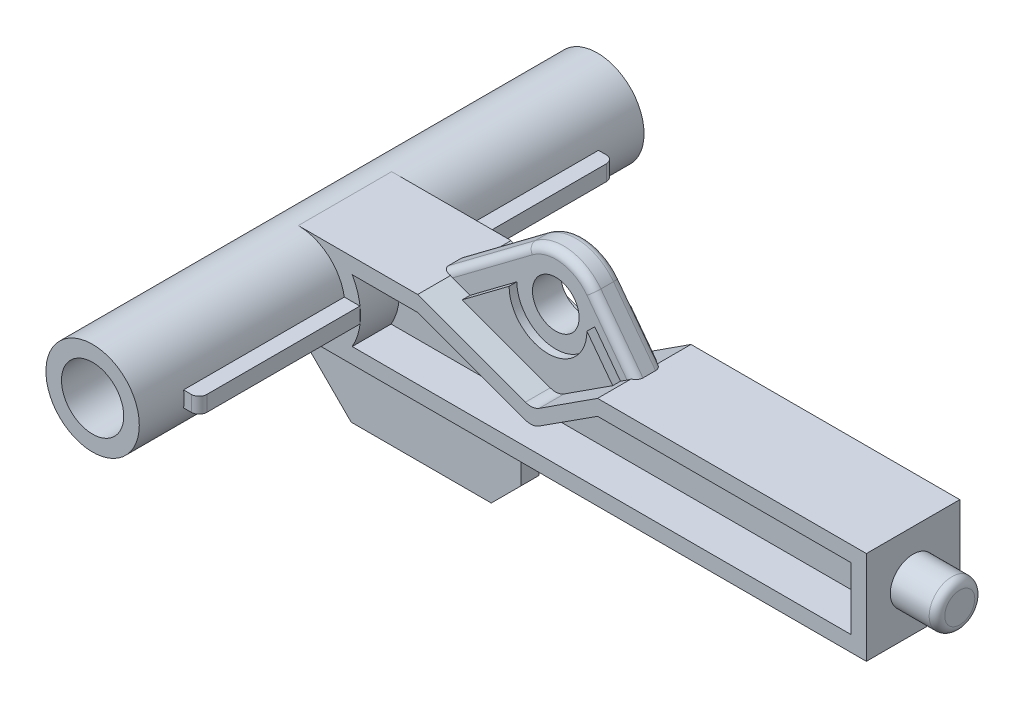
from build123d import *

# Parameters (mm, degrees)
BOSS_EXTRUDE3_DEPTH  = 3
SKETCH6_R            = 1.465
BOSS_EXTRUDE7_DEPTH  = 3
FILLET1_R            = 0.5
SKETCH7_R            = 2.9999999999999982
BOSS_EXTRUDE8_DEPTH  = 16.215
BOSS_EXTRUDE9_DEPTH  = 1.405
SKETCH9_R            = 2
CUT_EXTRUDE1_DEPTH   = 35
SKETCH10_R           = 1.5000000000000009
CUT_EXTRUDE2_DEPTH   = 35
CUT_EXTRUDE3_DEPTH   = 2.5
CUT_EXTRUDE4_START   = -2.5
CUT_EXTRUDE4_DEPTH   = 2.5
BOSS_EXTRUDE10_DEPTH = 0.59
BOSS_EXTRUDE11_DEPTH = 13.33
FILLET2_R            = 0.5
FILLET3_R            = 0.5
SKETCH12_R           = 1.5000000000000009
CUT_EXTRUDE5_DEPTH   = 0.5
FILLET4_R            = 0.5
CUT_EXTRUDE6_START   = -0.5
SKETCH17_R           = 1.5000000000000009
CUT_EXTRUDE6_DEPTH   = 0.5
FILLET5_R            = 0.5


with BuildPart() as part:
    # Sketch1 → Boss-Extrude3 (new, symmetric)
    with BuildSketch(Plane.XY):
        with BuildLine():
            ThreePointArc((2.9999999999999982, 2.9999999999999973), (2.1213203435596406, 0.8786796564403563), (-5.5e-16, 0))
            Line((0, 0), (36.5, 0))
            Line((36.5, 0), (36.5, 6))
            Line((36.5, 6), (19.23, 5.999999999999999))
            Line((19.23, 5.999999999999999), (15.480454164508112, 3.571071981637192))
            ThreePointArc((15.480454164508112, 3.571071981637192), (15.048841816271192, 3.4166611598413845), (14.593679363207029, 3.4710584241003293))
            Line((14.593679363207029, 3.4710584241003297), (7.67, 5.999999999999995))
            Line((7.67, 5.999999999999995), (0, 5.9999999999999964))
            ThreePointArc((1.8e-16, 5.9999999999999964), (2.1213203435596415, 5.121320343559639), (2.9999999999999982, 2.9999999999999982))
        make_face()
    extrude(amount=BOSS_EXTRUDE3_DEPTH, both=True)

    # Sketch6 → Boss-Extrude7 (add)
    with BuildSketch(Plane(origin=(36.5, 0, 0), x_dir=(0, 0, -1), z_dir=(1, 0, 0))):
        with Locations((0, 2.999999999999999)):
            Circle(SKETCH6_R)
    extrude(amount=BOSS_EXTRUDE7_DEPTH)

    # Fillet1
    fillet1_edges = [part.edges().sort_by_distance(p)[0] for p in [
        (39.5, 2.9999999999999987, 1.465),
    ]]
    fillet(fillet1_edges, radius=FILLET1_R)

    # Sketch7 → Boss-Extrude8 (add, symmetric)
    with BuildSketch(Plane.XY):
        with Locations((0, 2.9999999999999982)):
            Circle(SKETCH7_R)
    extrude(amount=BOSS_EXTRUDE8_DEPTH, both=True)

    # Sketch8 → Boss-Extrude9 (add, symmetric)
    with BuildSketch(Plane.XY):
        with BuildLine():
            Line((7.055802237198053, 5.999999999999995), (7.67, 5.999999999999995))
            Line((7.67, 5.999999999999995), (7.67, 2.7155970544612273))
            Line((7.67, 2.7155970544612273), (19.552760462470925, 2.7155970544612273))
            Line((19.552760462470925, 2.7155970544612273), (19.552760462470925, 5.999999999999999))
            Line((19.552760462470925, 5.999999999999999), (16.849844518078097, 9.600752353739953))
            ThreePointArc((16.849844518078097, 9.600752353739953), (14.873619928851438, 10.76977515573235), (12.649594170011149, 10.19899729819309))
            Line((12.649594170011149, 10.19899729819309), (7.055802237198053, 5.999999999999995))
        make_face()
    extrude(amount=BOSS_EXTRUDE9_DEPTH, both=True)

    # Sketch9 → Cut-Extrude1 (cut)
    with BuildSketch(Plane.XY.offset(16.215)):
        with Locations((0, 2.9999999999999982)):
            Circle(SKETCH9_R)
    extrude(amount=-CUT_EXTRUDE1_DEPTH, mode=Mode.SUBTRACT)

    # Sketch10 → Cut-Extrude2 (cut)
    with BuildSketch(Plane.XY.offset(1.405)):
        with Locations((14.450596871818059, 7.799749651933077)):
            Circle(SKETCH10_R)
    extrude(amount=-CUT_EXTRUDE2_DEPTH, mode=Mode.SUBTRACT)

    # Sketch11 → Cut-Extrude3 (cut)
    with BuildSketch(Plane.XY.offset(3)):
        with BuildLine():
            Line((35.5, 4.999999999999999), (19.23, 4.999999999999999))
            Line((19.23, 4.999999999999999), (15.46672588726192, 2.5741759140057563))
            ThreePointArc((15.46672588726192, 2.5741759140057563), (15.035884938334876, 2.420860249555603), (14.581839900445662, 2.475382903620951))
            Line((14.581839900445662, 2.475382903620951), (7.67, 4.9999999999999964))
            Line((7.67, 4.9999999999999964), (3.4641016151377535, 4.9999999999999964))
            ThreePointArc((3.464101615137754, 4.9999999999999964), (3.999999999999998, 2.9999999999999982), (3.464101615137754, 0.9999999999999998))
            Line((3.4641016151377535, 0.9999999999999999), (35.5, 1))
            Line((35.5, 1), (35.5, 4.999999999999999))
        make_face()
    extrude(amount=-CUT_EXTRUDE3_DEPTH, mode=Mode.SUBTRACT)

    # Sketch14 → Cut-Extrude4 (cut)
    with BuildSketch(Plane(origin=(0, 0, -3), x_dir=(-1, 0, 0), z_dir=(0, 0, -1)).offset(CUT_EXTRUDE4_START)):
        with BuildLine():
            Line((-19.23, 4.999999999999999), (-35.5, 4.999999999999999))
            Line((-35.5, 4.999999999999999), (-35.5, 1))
            Line((-35.5, 1), (-3.46410161513775, 1))
            ThreePointArc((-3.4641016151377535, 1), (-3.999999999999998, 2.9999999999999982), (-3.4641016151377535, 4.9999999999999964))
            Line((-3.4641016151377535, 4.9999999999999964), (-7.67, 4.9999999999999964))
            Line((-7.67, 4.9999999999999964), (-14.593679363207022, 2.471058424100332))
            ThreePointArc((-14.593679363207022, 2.471058424100332), (-15.048841816271192, 2.4166611598413854), (-15.480454164508119, 2.5710719816371976))
            Line((-15.480454164508119, 2.571071981637197), (-19.23, 4.999999999999999))
        make_face()
    extrude(amount=CUT_EXTRUDE4_DEPTH, mode=Mode.SUBTRACT)

    # Sketch15 → Boss-Extrude10 (add, symmetric)
    with BuildSketch(Plane.XY):
        with BuildLine():
            Line((11.889999999999997, -3.01e-15), (11.889999999999997, -3.750000000000003))
            Line((11.889999999999997, -3.750000000000003), (9.987882758608185, -5.652117241391816))
            Line((9.987882758608185, -5.652117241391816), (0.9878827586081856, -5.652117241391818))
            Line((0.9878827586081856, -5.652117241391818), (-2.7244278426211888, -1.9398066401624436))
            Line((-2.7244278426211888, -1.9398066401624436), (-2.7244278426211888, 1.7440171456781548))
            ThreePointArc((-2.7244278426211888, 1.7440171456781548), (-1.6174132800608587, 0.47334721786258305), (0, 0))
            Line((0, 0), (11.889999999999997, -3.01e-15))
        make_face()
    extrude(amount=BOSS_EXTRUDE10_DEPTH, both=True)

    # Sketch16 → Boss-Extrude11 (add, symmetric)
    with BuildSketch(Plane.XY):
        with BuildLine():
            Line((3.9580398915498063, 2.4999999999999982), (3.9580398915498063, 3.4999999999999982))
            Line((3.9580398915498063, 3.4999999999999982), (2.9580398915498067, 3.4999999999999982))
            ThreePointArc((2.9580398915498067, 3.4999999999999982), (2.9999999999999925, 2.9999999999999982), (2.9580398915498067, 2.4999999999999982))
            Line((2.9580398915498067, 2.4999999999999982), (3.9580398915498063, 2.4999999999999982))
        make_face()
    extrude(amount=BOSS_EXTRUDE11_DEPTH, both=True)

    # Fillet2
    fillet2_edges = [part.edges().sort_by_distance(p)[0] for p in [
        (3.9580398915498063, 2.9999999999999982, 13.33),
    ]]
    fillet(fillet2_edges, radius=FILLET2_R)

    # Fillet3
    fillet3_edges = [part.edges().sort_by_distance(p)[0] for p in [
        (3.9580398915498063, 2.9999999999999982, -13.33),
    ]]
    fillet(fillet3_edges, radius=FILLET3_R)

    # Sketch12 → Cut-Extrude5 (cut)
    with BuildSketch(Plane.XY.offset(1.405)):
        with BuildLine():
            Line((8.93667028661393, 5.537336294370084), (11.950596871818057, 7.799749651933077))
            ThreePointArc((11.950596871818057, 7.799749651933077), (14.45059687181806, 5.299749651933041), (16.950596871818053, 7.7997496519330864))
            Line((16.95059687181806, 7.799749651933077), (18.60533758587746, 5.595348315169656))
            Line((18.60533758587746, 5.595348315169656), (19.230000000000004, 5.999999999999997))
            Line((19.230000000000004, 5.999999999999997), (19.552760462470925, 5.999999999999999))
            Line((19.552760462470925, 5.999999999999999), (16.849844518078097, 9.600752353739953))
            ThreePointArc((16.849844518078097, 9.600752353739953), (14.873619928851436, 10.769775155732342), (12.649594170011149, 10.19899729819309))
            Line((12.649594170011149, 10.19899729819309), (7.055802237198053, 5.999999999999995))
            Line((7.055802237198053, 5.999999999999995), (7.67, 5.999999999999995))
            Line((7.67, 5.999999999999995), (8.93667028661393, 5.537336294370084))
        make_face()
        with Locations((14.450596871818059, 7.799749651933077)):
            Circle(SKETCH12_R, mode=Mode.SUBTRACT)
    extrude(amount=-CUT_EXTRUDE5_DEPTH, mode=Mode.SUBTRACT)

    # Fillet4
    fillet4_edges = [part.edges().sort_by_distance(p)[0] for p in [
        (18.20130249027451, 7.800376176869976, 0.905),
        (9.8526982036046, 8.099498649096542, 0.905),
        (14.873619928851436, 10.769775155732344, 0.905),
    ]]
    fillet(fillet4_edges, radius=FILLET4_R)

    # Sketch17 → Cut-Extrude6 (cut)
    with BuildSketch(Plane(origin=(0, 0, -1.405), x_dir=(-1, 0, 0), z_dir=(0, 0, -1)).offset(CUT_EXTRUDE6_START)):
        with BuildLine():
            Line((-18.60533758587746, 5.595348315169656), (-16.95059687181806, 7.799749651933077))
            ThreePointArc((-16.95059687181806, 7.799749651933077), (-14.450596871818068, 5.299749651933066), (-11.950596871818057, 7.79974965193306))
            Line((-11.950596871818059, 7.799749651933077), (-8.93667028661393, 5.537336294370084))
            Line((-8.93667028661393, 5.537336294370084), (-7.67, 5.999999999999995))
            Line((-7.67, 5.999999999999995), (-7.055802237198053, 5.999999999999995))
            Line((-7.055802237198053, 5.999999999999995), (-12.649594170011149, 10.19899729819309))
            ThreePointArc((-12.649594170011149, 10.19899729819309), (-14.873619928851438, 10.769775155732347), (-16.849844518078097, 9.600752353739953))
            Line((-16.849844518078097, 9.600752353739953), (-19.552760462470925, 5.999999999999999))
            Line((-19.552760462470925, 5.999999999999999), (-19.23, 5.999999999999999))
            Line((-19.23, 5.999999999999999), (-18.60533758587746, 5.595348315169656))
        make_face()
        with Locations((-14.450596871818059, 7.799749651933077)):
            Circle(SKETCH17_R, mode=Mode.SUBTRACT)
    extrude(amount=CUT_EXTRUDE6_DEPTH, mode=Mode.SUBTRACT)

    # Fillet5
    fillet5_edges = [part.edges().sort_by_distance(p)[0] for p in [
        (9.8526982036046, 8.099498649096542, -0.905),
        (18.20130249027451, 7.800376176869976, -0.905),
        (14.873619928851438, 10.769775155732347, -0.905),
    ]]
    fillet(fillet5_edges, radius=FILLET5_R)


solid = part.part
